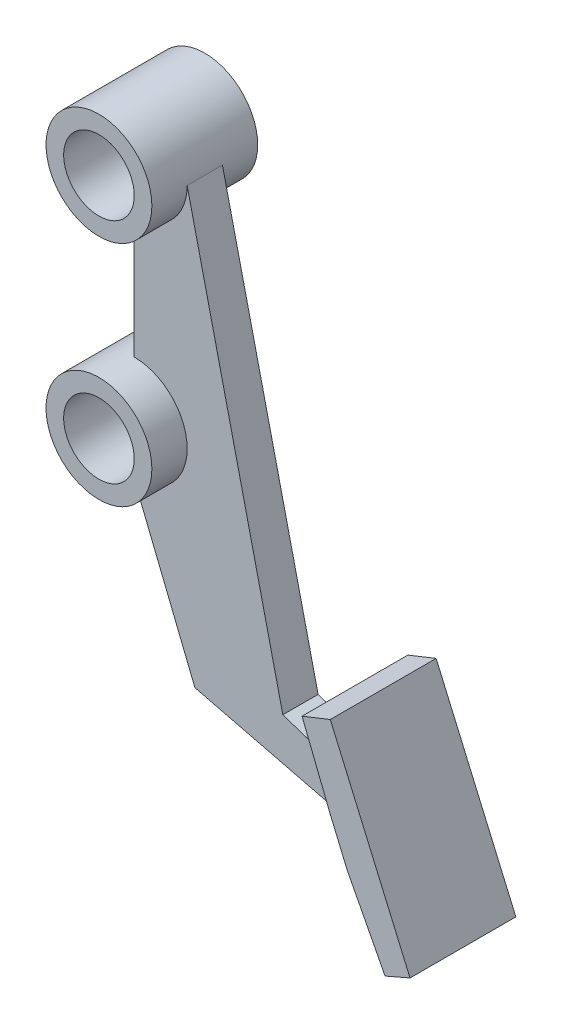
from build123d import *

# Parameters (mm, degrees)
DODANIE_WYCI_GNI_CIE1_DEPTH = 5
SZKIC1_3_R                  = 15
SZKIC1_3_R_2                = 10
DODANIE_WYCI_GNI_CIE2_DEPTH = 15


with BuildPart() as part:
    # Szkic1 → Dodanie-wyciągnięcie1 (new, symmetric)
    with BuildSketch(Plane.XY):
        with BuildLine():
            Line((0, 49.610742159), (0, 15))
            ThreePointArc((0, 15), (10.606601718, 10.606601718), (15, 0))
            ThreePointArc((15, 0), (10.606601718, -10.606601718), (0, -15))
            Line((0, -15), (17.201404847, -57.569734598))
            Line((17.201404847, -57.569734598), (70.321075739, -70.682872454))
            Line((70.321075739, -70.682872454), (65.579282521, -59.511367123))
            Line((65.579282521, -59.511367123), (42.119104174, -51.763052014))
            Line((42.119104174, -51.763052014), (15, 64.610742159))
            ThreePointArc((15, 64.610742159), (10.606601718, 54.004140441), (0, 49.610742159))
        make_face()
    extrude(amount=DODANIE_WYCI_GNI_CIE1_DEPTH, both=True)

    # Szkic1<3> → Dodanie-wyciągnięcie2 (add, symmetric)
    # profile 1 of 3: a face of its own
    with BuildSketch(Plane.XY):
        Circle(SZKIC1_3_R)
        Circle(SZKIC1_3_R_2, mode=Mode.SUBTRACT)
    # profile 2 of 3: a face of its own
    with BuildSketch(Plane.XY):
        with Locations((0, 64.610742159)):
            Circle(SZKIC1_3_R)
        with Locations((0, 64.610742159)):
            Circle(SZKIC1_3_R_2, mode=Mode.SUBTRACT)
    # profile 3 of 3: a face of its own
    with BuildSketch(Plane.XY):
        Polygon((65.579282521, -59.511367123), (70.321075739, -70.682872454), (81.099328917, -91.419597771), (88.178535072, -88.35231955), (65.579282521, -36.193774991), (57.564045894, -39.385959721), align=None)
    extrude(amount=DODANIE_WYCI_GNI_CIE2_DEPTH, both=True)


solid = part.part
